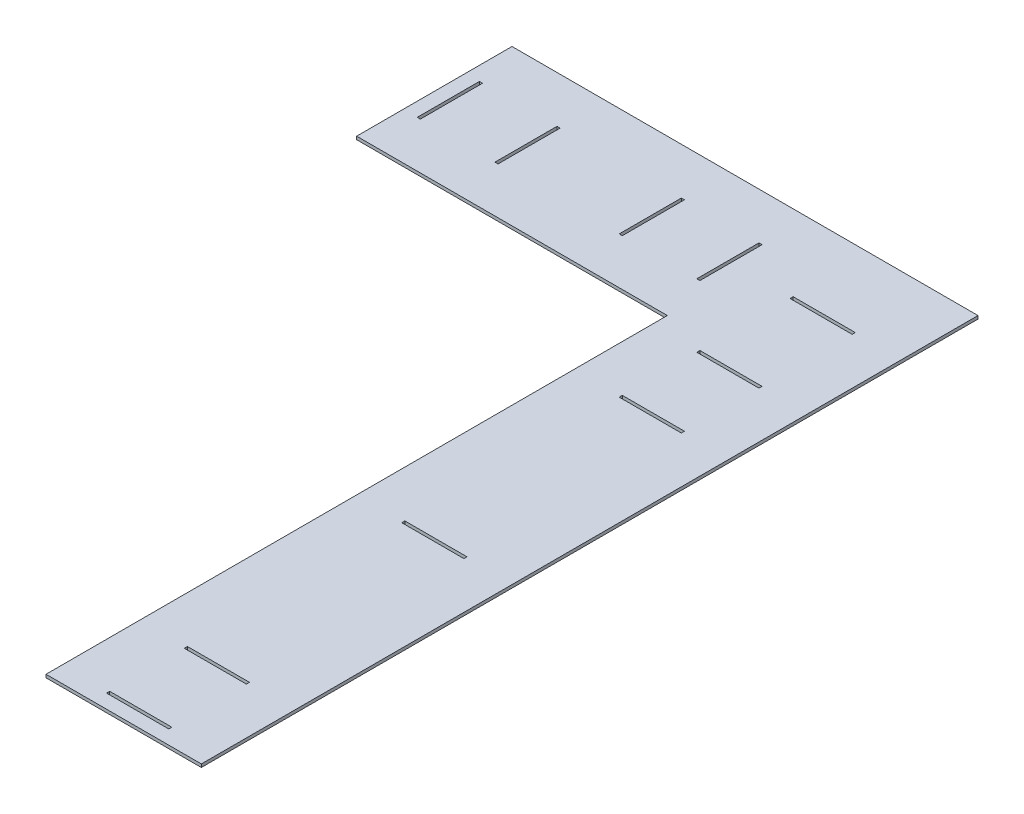
from build123d import *

# Parameters (mm, degrees)
SKETCH1_W           = 1
SKETCH1_H           = 20
SKETCH1_W_2         = 20
SKETCH1_H_2         = 1
BOSS_EXTRUDE1_DEPTH = 1


with BuildPart() as part:
    # Sketch1 → Boss-Extrude1 (new body)
    with BuildSketch(Plane(origin=(0, 0, 0), x_dir=(1, 0, 0), z_dir=(0, 1, 0))):
        Polygon((0, 0), (100, 0), (100, -200), (150, -200), (150, 50), (0, 50), align=None)
        with Locations((5, 25)):
            Rectangle(SKETCH1_W, SKETCH1_H, mode=Mode.SUBTRACT)
        with Locations((30, 25)):
            Rectangle(SKETCH1_W, SKETCH1_H, mode=Mode.SUBTRACT)
        with Locations((95, 25)):
            Rectangle(SKETCH1_W, SKETCH1_H, mode=Mode.SUBTRACT)
        with Locations((125, -5)):
            Rectangle(SKETCH1_W_2, SKETCH1_H_2, mode=Mode.SUBTRACT)
        with Locations((125, -30)):
            Rectangle(SKETCH1_W_2, SKETCH1_H_2, mode=Mode.SUBTRACT)
        with Locations((125, -100)):
            Rectangle(SKETCH1_W_2, SKETCH1_H_2, mode=Mode.SUBTRACT)
        with Locations((125, -195)):
            Rectangle(SKETCH1_W_2, SKETCH1_H_2, mode=Mode.SUBTRACT)
        with Locations((125, -170)):
            Rectangle(SKETCH1_W_2, SKETCH1_H_2, mode=Mode.SUBTRACT)
        with Locations((125, 25)):
            Rectangle(SKETCH1_W_2, SKETCH1_H_2, mode=Mode.SUBTRACT)
        with Locations((70, 25)):
            Rectangle(SKETCH1_W, SKETCH1_H, mode=Mode.SUBTRACT)
    extrude(amount=BOSS_EXTRUDE1_DEPTH)


solid = part.part
